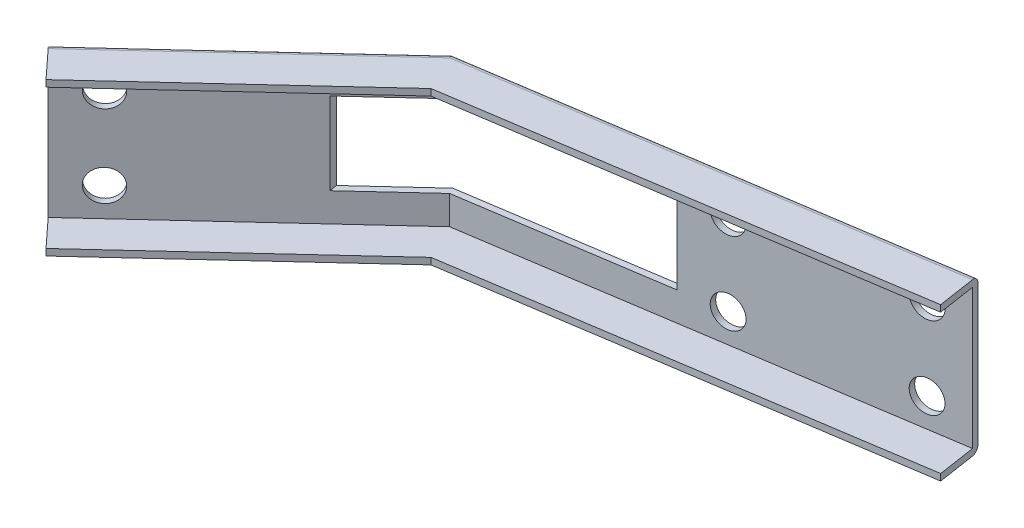
from build123d import *

# Parameters (mm, degrees)
BOSS_EXTRUDE1_DEPTH = 26.64
BOSS_EXTRUDE2_DEPTH = 1.25
BOSS_EXTRUDE3_DEPTH = 1.25
FILLET1_R           = 1.25
SKETCH4_R           = 3
CUT_EXTRUDE1_DEPTH  = 1.25
BOSS_EXTRUDE4_START = 1.25
BOSS_EXTRUDE4_DEPTH = 1.25
SKETCH6_R           = 3
CUT_EXTRUDE2_DEPTH  = 1.25
BOSS_EXTRUDE5_DEPTH = 1.25
SKETCH8_W           = 51.440869123
SKETCH8_H           = 15.64
CUT_EXTRUDE3_DEPTH  = 21.25


with BuildPart() as part:
    # Sketch1 → Boss-Extrude1 (new body)
    with BuildSketch(Plane(origin=(0, 0, 0), x_dir=(1, 0, 0), z_dir=(0, 1, 0))):
        Polygon((83.457182963, 20.606052526), (-1.816223719, 7.555013068), (-40.71695424, -28.343507726), (-41.564678823, -27.424887548), (-2.383097929, 8.732808661), (83.268073317, 21.841664739), align=None)
    extrude(amount=BOSS_EXTRUDE1_DEPTH)

    # Sketch2 → Boss-Extrude2 (add)
    with BuildSketch(Plane(origin=(0, 26.64, 0), x_dir=(1, 0, 0), z_dir=(0, 1, 0))):
        Polygon((83.268073317, 21.841664739), (84.55401891, 13.439501688), (1.471646699, 0.723798632), (-35.800151659, -33.671504758), (-41.564678823, -27.424887548), (-2.383097929, 8.732808661), align=None)
    extrude(amount=BOSS_EXTRUDE2_DEPTH)

    # Sketch3 → Boss-Extrude3 (add)
    with BuildSketch(Plane.XZ):
        Polygon((83.268073317, -21.841664739), (84.55401891, -13.439501688), (1.471646699, -0.723798632), (-35.800151659, 33.671504758), (-41.564678823, 27.424887548), (-2.383097929, -8.732808661), align=None)
    extrude(amount=BOSS_EXTRUDE3_DEPTH)

    # Fillet1
    fillet1_edges = [part.edges().sort_by_distance(p)[0] for p in [
        (40.442487694, 27.89, -15.2872367),
        (-21.973888376, 27.89, 9.346039443),
        (40.442487694, -1.25, -15.2872367),
        (-21.973888376, -1.25, 9.346039443),
    ]]
    fillet(fillet1_edges, radius=FILLET1_R)

    # Sketch4 → Cut-Extrude1 (cut)
    with BuildSketch(Plane(origin=(-1.360504034, 0, -8.889315992), x_dir=(-0.98848977068378, 0, 0.15128771679659964), z_dir=(-0.15128771679659964, 0, -0.98848977068378))):
        with Locations((-79.264014288, 21.14)):
            Circle(SKETCH4_R)
        with Locations((-45.964014288, 21.14)):
            Circle(SKETCH4_R)
        with Locations((-45.964014288, 5.5)):
            Circle(SKETCH4_R)
        with Locations((-79.264014288, 5.5)):
            Circle(SKETCH4_R)
    extrude(amount=-CUT_EXTRUDE1_DEPTH, mode=Mode.SUBTRACT)

    # Sketch5 → Boss-Extrude4 (add)
    with BuildSketch(Plane(origin=(84.628577351, 0, -12.952348747), x_dir=(-0.15128771679660272, 0, -0.9884897706837796), z_dir=(0.9884897706837796, 0, -0.15128771679660272)).offset(BOSS_EXTRUDE4_START)):
        with BuildLine():
            Line((0.492825475, -1.25), (7.742825475, -1.25))
            ThreePointArc((7.742825475, -1.25), (8.626708952, -0.883883476), (8.992825475, 0))
            Line((8.992825475, 0), (8.992825475, 26.64))
            ThreePointArc((8.992825475, 26.64), (8.626708952, 27.523883476), (7.742825475, 27.89))
            Line((7.742825475, 27.89), (0.492825475, 27.89))
            Line((0.492825475, 27.89), (0.492825475, 26.64))
            Line((0.492825475, 26.64), (7.742825475, 26.64))
            Line((7.742825475, 26.64), (7.742825475, 0))
            Line((7.742825475, 0), (0.492825475, 0))
            Line((0.492825475, 0), (0.492825475, -1.25))
        make_face()
    extrude(amount=-BOSS_EXTRUDE4_DEPTH)

    # Sketch6 → Cut-Extrude2 (cut)
    with BuildSketch(Plane(origin=(-5.448411315, 0, -5.904064448), x_dir=(-0.7348961423682216, 0, 0.6781796664102415), z_dir=(-0.6781796664102415, 0, -0.7348961423682216))):
        with Locations((42.794723214, 5.5)):
            Circle(SKETCH6_R)
        with Locations((42.794723214, 21.14)):
            Circle(SKETCH6_R)
    extrude(amount=-CUT_EXTRUDE2_DEPTH, mode=Mode.SUBTRACT)

    # Sketch7 → Boss-Extrude5 (add)
    with BuildSketch(Plane(origin=(-36.116267508, 0, 33.328951995), x_dir=(0.6781796664102416, 0, 0.7348961423682215), z_dir=(-0.7348961423682215, 0, 0.6781796664102416))):
        with BuildLine():
            Line((-8.033875955, 26.64), (-8.033875955, 0))
            ThreePointArc((-8.033875955, 0), (-7.667759432, -0.883883476), (-6.783875955, -1.25))
            Line((-6.783875955, -1.25), (0.466124045, -1.25))
            Line((0.466124045, -1.25), (0.466124045, 0))
            Line((0.466124045, 0), (-6.783875955, 0))
            Line((-6.783875955, 0), (-6.783875955, 26.64))
            Line((-6.783875955, 26.64), (0.466124045, 26.64))
            Line((0.466124045, 26.64), (0.466124045, 27.89))
            Line((0.466124045, 27.89), (-6.783875955, 27.89))
            ThreePointArc((-6.783875955, 27.89), (-7.667759432, 27.523883476), (-8.033875955, 26.64))
        make_face()
    extrude(amount=BOSS_EXTRUDE5_DEPTH)

    # Sketch8 → Cut-Extrude3 (cut)
    with BuildSketch(Plane(origin=(-1.360504034, 0, -8.889315992), x_dir=(-0.98848977068378, 0, 0.15128771679659964), z_dir=(-0.15128771679659964, 0, -0.98848977068378))):
        with Locations((-11.673373202, 13.32)):
            Rectangle(SKETCH8_W, SKETCH8_H)
    extrude(amount=-CUT_EXTRUDE3_DEPTH, mode=Mode.SUBTRACT)


solid = part.part
